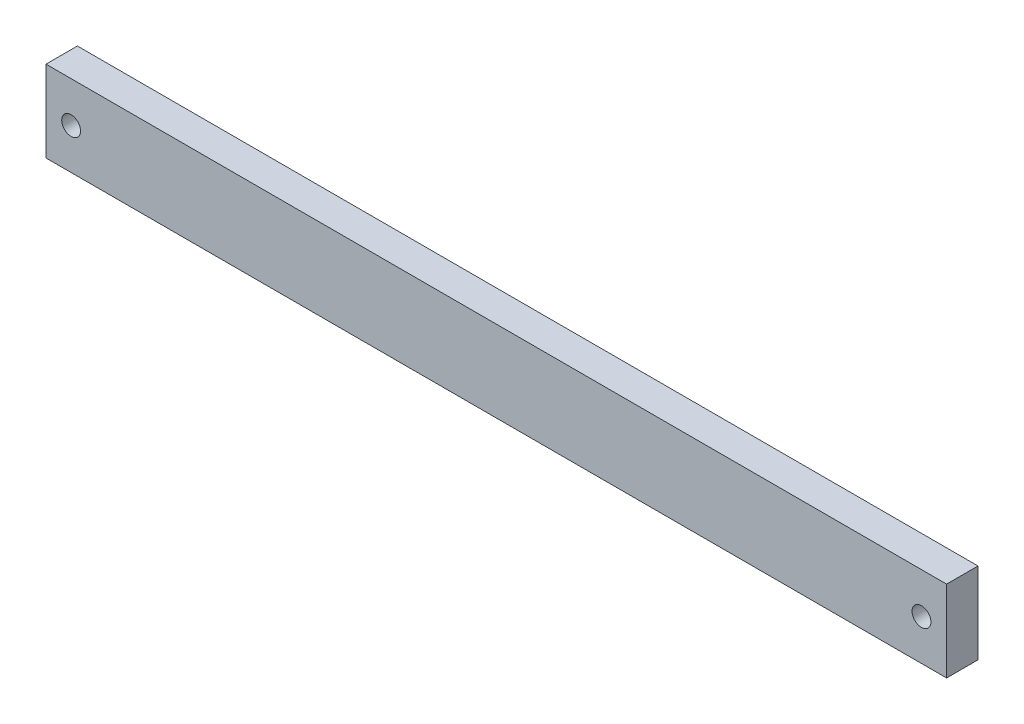
from build123d import *

# Parameters (mm, degrees)
SKETCH1_W               = 717
SKETCH1_H               = 64.740437158
BOSS_EXTRUDE1_DEPTH     = 25
CUT_EXTRUDE1_DEPTH      = 361.825554875
CUT_EXTRUDE1_DEPTH_BACK = 361.825554875
SKETCH2_R               = 7.5


with BuildPart() as part:
    # Sketch1 → Boss-Extrude1 (new body)
    with BuildSketch(Plane.XY):
        Rectangle(SKETCH1_W, SKETCH1_H)
    extrude(amount=BOSS_EXTRUDE1_DEPTH)

    # Sketch2 → Cut-Extrude1 (cut, two sides: drawn at the far end of the back side and taken through both)
    with BuildSketch(Plane(origin=(0, 0, 0), x_dir=(-1, 0, 0), z_dir=(0, 0, -1)).offset(-CUT_EXTRUDE1_DEPTH_BACK)):
        with Locations((-338.5, 0)):
            Circle(SKETCH2_R)
        with Locations((338.5, 0)):
            Circle(SKETCH2_R)
    extrude(amount=CUT_EXTRUDE1_DEPTH + CUT_EXTRUDE1_DEPTH_BACK, mode=Mode.SUBTRACT)


solid = part.part
